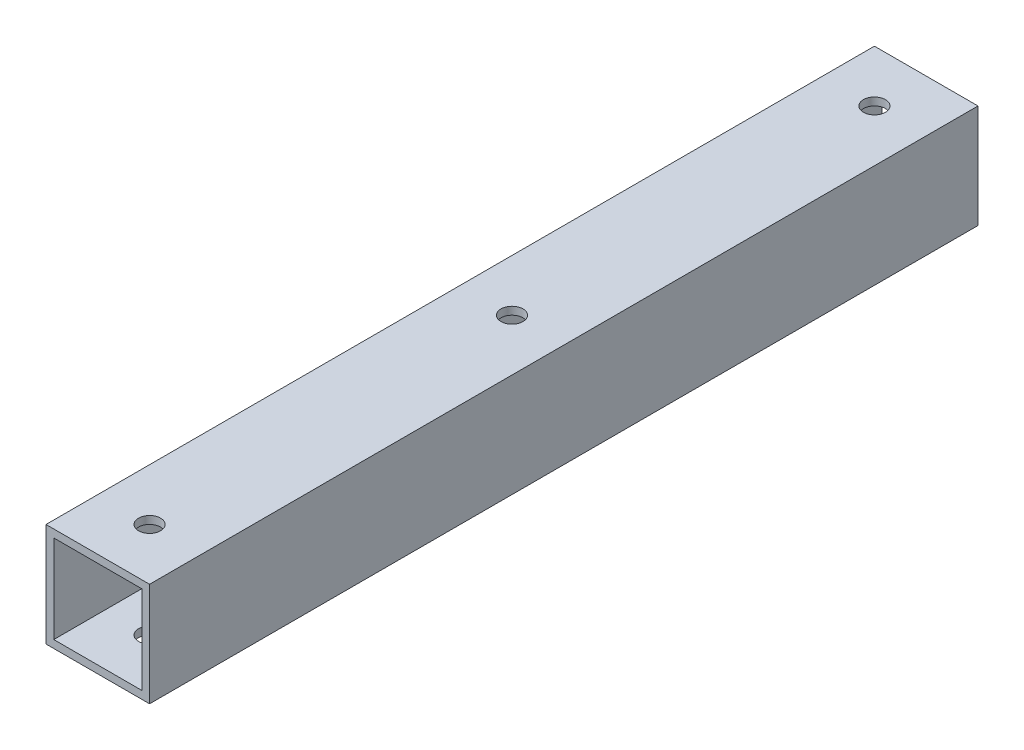
from build123d import *

# Parameters (mm, degrees)
SKETCH1_W           = 20
SKETCH1_H           = 20
SKETCH1_W_2         = 17
SKETCH1_H_2         = 17
BOSS_EXTRUDE1_DEPTH = 160
SKETCH2_R           = 2.125
CUT_EXTRUDE1_DEPTH  = 162.554944214


with BuildPart() as part:
    # Sketch1 → Boss-Extrude1 (new body)
    with BuildSketch(Plane.XY):
        Rectangle(SKETCH1_W, SKETCH1_H)
        Rectangle(SKETCH1_W_2, SKETCH1_H_2, mode=Mode.SUBTRACT)
    extrude(amount=-BOSS_EXTRUDE1_DEPTH)

    # Sketch2 → Cut-Extrude1 (cut, through all)
    with BuildSketch(Plane(origin=(0, 10, 0), x_dir=(1, 0, 0), z_dir=(0, 1, 0))):
        with Locations(Location((0, 10, 0), (0, 0, 270))):
            Circle(SKETCH2_R)
        with Locations(Location((0, 80, 0), (0, 0, 270))):
            Circle(SKETCH2_R)
        with Locations(Location((0, 150, 0), (0, 0, 270))):
            Circle(SKETCH2_R)
    extrude(amount=-CUT_EXTRUDE1_DEPTH, mode=Mode.SUBTRACT)


solid = part.part
